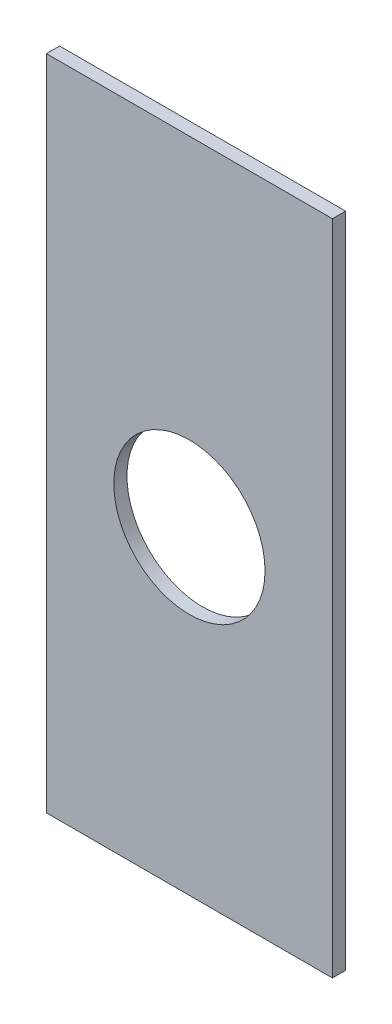
from build123d import *

# Parameters (mm, degrees)
SKETCH_1_R      = 23
EXTRUDE_1_DEPTH = 4


with BuildPart() as part:
    # 草图1 → 凸台-拉伸1 (new body)
    with BuildSketch(Plane.XY):
        Polygon((37.5, 50), (-37.5, 50), (-43.5, 50), (-43.5, -50), (-43.5, -150), (-37.5, -150), (37.5, -150), (43.5, -150), (43.5, -50), (43.5, 50), align=None)
        with Locations((0, -53)):
            Circle(SKETCH_1_R, mode=Mode.SUBTRACT)
    extrude(amount=EXTRUDE_1_DEPTH)


solid = part.part
